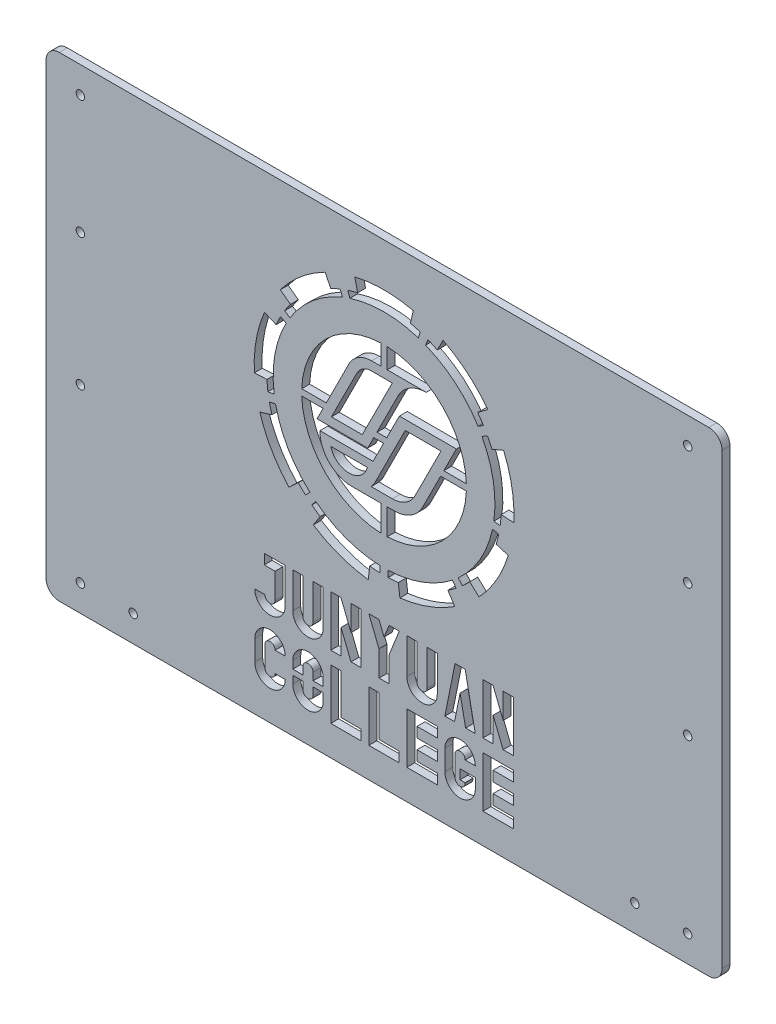
from build123d import *

# Parameters (mm, degrees)
MODEL_R             = 1.6
BOSS_EXTRUDE1_DEPTH = 3


with BuildPart() as part:
    # Model → Boss-Extrude1 (new body)
    with BuildSketch(Plane.XY):
        with BuildLine():
            Line((7.715859844, 183.30897554), (253.715859844, 183.30897554))
            ThreePointArc((253.715859844, 183.30897554), (257.251393749, 181.844509446), (258.715859844, 178.30897554))
            Line((258.715859844, 178.30897554), (258.715859844, 8.30897554))
            ThreePointArc((258.715859844, 8.30897554), (257.251393749, 4.773441634), (253.715859844, 3.30897554))
            Line((253.715859844, 3.30897554), (7.715859844, 3.30897554))
            ThreePointArc((7.715859844, 3.30897554), (4.180325938, 4.773441634), (2.715859844, 8.30897554))
            Line((2.715859844, 8.30897554), (2.715859844, 178.30897554))
            ThreePointArc((2.715859844, 178.30897554), (4.180325938, 181.844509446), (7.715859844, 183.30897554))
        make_face()
        with Locations((15.715859844, 173.30897554)):
            Circle(MODEL_R, mode=Mode.SUBTRACT)
        with Locations((15.715859844, 128.30897554)):
            Circle(MODEL_R, mode=Mode.SUBTRACT)
        with Locations((15.715859844, 78.30897554)):
            Circle(MODEL_R, mode=Mode.SUBTRACT)
        with Locations((245.715859844, 173.30897554)):
            Circle(MODEL_R, mode=Mode.SUBTRACT)
        with Locations((245.715859844, 128.30897554)):
            Circle(MODEL_R, mode=Mode.SUBTRACT)
        with Locations((245.715859844, 78.30897554)):
            Circle(MODEL_R, mode=Mode.SUBTRACT)
        with Locations((15.715859844, 13.30897554)):
            Circle(MODEL_R, mode=Mode.SUBTRACT)
        with Locations((245.715859844, 13.30897554)):
            Circle(MODEL_R, mode=Mode.SUBTRACT)
        with Locations((35.715859844, 13.30897554)):
            Circle(MODEL_R, mode=Mode.SUBTRACT)
        with Locations((225.715859844, 13.30897554)):
            Circle(MODEL_R, mode=Mode.SUBTRACT)
        with BuildLine():
            Line((140.703686656, 160.968449305), (141.783451717, 165.645425616))
            ThreePointArc((141.783451717, 165.645425616), (130.715859844, 166.906418428), (119.64826797, 165.645425616))
            Line((119.64826797, 165.645425616), (120.728033031, 160.968449305))
            ThreePointArc((120.728033031, 160.968449305), (118.850475946, 160.491610551), (116.995505293, 159.933327752))
            Line((116.995505293, 159.933327752), (117.73714608, 157.650792113))
            ThreePointArc((117.73714608, 157.650792113), (130.715859844, 159.706418428), (143.694573607, 157.650792113))
            Line((143.694573607, 157.650792113), (144.436214394, 159.933327752))
            ThreePointArc((144.436214394, 159.933327752), (142.581243741, 160.491610551), (140.703686656, 160.968449305))
        make_face(mode=Mode.SUBTRACT)
        with BuildLine():
            Line((110.558681655, 157.267108102), (108.379527256, 161.543939418))
            ThreePointArc((108.379527256, 161.543939418), (99.090709447, 155.39580503), (91.422992749, 147.315717567))
            Line((91.422992749, 147.315717567), (95.256443197, 144.427005456))
            ThreePointArc((95.256443197, 144.427005456), (94.124657069, 142.854855348), (93.062524374, 141.23483376))
            Line((93.062524374, 141.23483376), (95.097839805, 139.963027526))
            ThreePointArc((95.097839805, 139.963027526), (103.718780237, 149.880285039), (114.98238292, 156.64814032))
            Line((114.98238292, 156.64814032), (114.083327096, 158.873381571))
            ThreePointArc((114.083327096, 158.873381571), (112.30347987, 158.108698855), (110.558681655, 157.267108102))
        make_face(mode=Mode.SUBTRACT)
        with BuildLine():
            Line((89.84544435, 135.054880533), (85.427021054, 136.93038995))
            ThreePointArc((85.427021054, 136.93038995), (82.263318395, 126.249908769), (81.583286734, 115.131489381))
            Line((81.583286734, 115.131489381), (86.3767085, 115.382701971))
            ThreePointArc((86.3767085, 115.382701971), (86.520268636, 113.450867016), (86.747957591, 111.527132746))
            Line((86.747957591, 111.527132746), (89.124600956, 111.861148188))
            ThreePointArc((89.124600956, 111.861148188), (89.353934217, 124.99964189), (93.632060943, 137.424224065))
            Line((93.632060943, 137.424224065), (91.512986721, 138.550955816))
            ThreePointArc((91.512986721, 138.550955816), (90.641073218, 136.821111127), (89.84544435, 135.054880533))
        make_face(mode=Mode.SUBTRACT)
        with BuildLine():
            Line((88.255928679, 104.725114739), (83.66566585, 103.321730556))
            ThreePointArc((83.66566585, 103.321730556), (88.107409977, 93.106418428), (94.733257724, 84.152099113))
            Line((94.733257724, 84.152099113), (98.243755492, 87.425691241))
            ThreePointArc((98.243755492, 87.425691241), (99.595488509, 86.038098486), (101.006460921, 84.710788177))
            Line((101.006460921, 84.710788177), (102.612374376, 86.494335758))
            ThreePointArc((102.612374376, 86.494335758), (94.342792885, 96.706418428), (89.633660613, 108.974127414))
            Line((89.633660613, 108.974127414), (87.286106371, 108.475139356))
            ThreePointArc((87.286106371, 108.475139356), (87.730104611, 106.589546248), (88.255928679, 104.725114739))
        make_face(mode=Mode.SUBTRACT)
        with BuildLine():
            Line((106.533886689, 80.469445211), (103.919619321, 76.443826485))
            ThreePointArc((103.919619321, 76.443826485), (113.888468792, 71.473541486), (124.719888148, 68.873147768))
            Line((124.719888148, 68.873147768), (125.304860996, 73.637369295))
            ThreePointArc((125.304860996, 73.637369295), (127.232275993, 73.443288811), (129.16632219, 73.333465709))
            Line((129.16632219, 73.333465709), (129.250080982, 75.732003693))
            ThreePointArc((129.250080982, 75.732003693), (116.351013824, 78.239328355), (104.85807788, 84.609966777))
            Line((104.85807788, 84.609966777), (103.380490339, 82.718740968))
            ThreePointArc((103.380490339, 82.718740968), (104.93264861, 81.559689413), (106.533886689, 80.469445211))
        make_face(mode=Mode.SUBTRACT)
        with BuildLine():
            Line((136.126858691, 73.637369295), (136.711831539, 68.873147768))
            ThreePointArc((136.711831539, 68.873147768), (147.543250895, 71.473541486), (157.512100366, 76.443826485))
            Line((157.512100366, 76.443826485), (154.897832998, 80.469445211))
            ThreePointArc((154.897832998, 80.469445211), (156.499071077, 81.559689413), (158.051229348, 82.718740968))
            Line((158.051229348, 82.718740968), (156.573641807, 84.609966777))
            ThreePointArc((156.573641807, 84.609966777), (145.080705863, 78.239328355), (132.181638705, 75.732003693))
            Line((132.181638705, 75.732003693), (132.265397497, 73.333465709))
            ThreePointArc((132.265397497, 73.333465709), (134.199443694, 73.443288811), (136.126858691, 73.637369295))
        make_face(mode=Mode.SUBTRACT)
        with BuildLine():
            Line((163.187964195, 87.425691241), (166.698461963, 84.152099113))
            ThreePointArc((166.698461963, 84.152099113), (173.32430971, 93.106418428), (177.766053837, 103.321730556))
            Line((177.766053837, 103.321730556), (173.175791008, 104.725114739))
            ThreePointArc((173.175791008, 104.725114739), (173.701615076, 106.589546248), (174.145613316, 108.475139356))
            Line((174.145613316, 108.475139356), (171.798059074, 108.974127414))
            ThreePointArc((171.798059074, 108.974127414), (167.088926802, 96.706418428), (158.819345311, 86.494335758))
            Line((158.819345311, 86.494335758), (160.425258766, 84.710788177))
            ThreePointArc((160.425258766, 84.710788177), (161.836231178, 86.038098486), (163.187964195, 87.425691241))
        make_face(mode=Mode.SUBTRACT)
        with BuildLine():
            Line((175.055011187, 115.382701971), (179.848432953, 115.131489381))
            ThreePointArc((179.848432953, 115.131489381), (179.168401292, 126.249908769), (176.004698633, 136.93038995))
            Line((176.004698633, 136.93038995), (171.586275337, 135.054880533))
            ThreePointArc((171.586275337, 135.054880533), (170.790646469, 136.821111127), (169.918732966, 138.550955816))
            Line((169.918732966, 138.550955816), (167.799658744, 137.424224065))
            ThreePointArc((167.799658744, 137.424224065), (172.07778547, 124.99964189), (172.307118731, 111.861148188))
            Line((172.307118731, 111.861148188), (174.683762096, 111.527132746))
            ThreePointArc((174.683762096, 111.527132746), (174.911451051, 113.450867016), (175.055011187, 115.382701971))
        make_face(mode=Mode.SUBTRACT)
        with BuildLine():
            Line((166.17527649, 144.427005456), (170.008726938, 147.315717567))
            ThreePointArc((170.008726938, 147.315717567), (162.34101024, 155.39580503), (153.052192431, 161.543939418))
            Line((153.052192431, 161.543939418), (150.873038032, 157.267108102))
            ThreePointArc((150.873038032, 157.267108102), (149.128239817, 158.108698855), (147.348392591, 158.873381571))
            Line((147.348392591, 158.873381571), (146.449336767, 156.64814032))
            ThreePointArc((146.449336767, 156.64814032), (157.71293945, 149.880285039), (166.333879882, 139.963027526))
            Line((166.333879882, 139.963027526), (168.369195313, 141.23483376))
            ThreePointArc((168.369195313, 141.23483376), (167.307062618, 142.854855348), (166.17527649, 144.427005456))
        make_face(mode=Mode.SUBTRACT)
        with BuildLine():
            Line((136.524344384, 128.433865169), (158.124344384, 128.433865169))
            Line((158.124344384, 128.433865169), (153.340149806, 118.906418428))
            Line((153.340149806, 118.906418428), (161.89277438, 118.906418428))
            ThreePointArc((161.89277438, 118.906418428), (152.777591417, 139.768150001), (131.915859844, 148.883332964))
            Line((131.915859844, 148.883332964), (131.915859844, 141.288514406))
            Line((131.915859844, 141.288514406), (146.683146191, 141.288514406))
            ThreePointArc((146.683146191, 141.288514406), (140.383140858, 139.501737834), (135.959252513, 134.673503206))
            Line((135.959252513, 134.673503206), (128.041832078, 118.906418428))
            Line((128.041832078, 118.906418428), (131.740149806, 118.906418428))
            Line((131.740149806, 118.906418428), (136.524344384, 128.433865169))
        make_face(mode=Mode.SUBTRACT)
        with BuildLine():
            Line((138.744996792, 124.833865169), (152.288221651, 124.833865169))
            Line((152.288221651, 124.833865169), (142.456251256, 105.2540649))
            ThreePointArc((142.456251256, 105.2540649), (138.91714058, 101.391477198), (133.877136314, 99.962055941))
            Line((133.877136314, 99.962055941), (125.833827302, 99.962055941))
            ThreePointArc((125.833827302, 99.962055941), (126.727093366, 101.111806319), (127.463654057, 102.36772373))
            Line((127.463654057, 102.36772373), (138.744996792, 124.833865169))
        make_face(mode=Mode.SUBTRACT)
        with BuildLine():
            Line((130.534993031, 116.506418428), (126.561498077, 108.593433092))
            Line((126.561498077, 108.593433092), (106.428991116, 108.593433092))
            ThreePointArc((106.428991116, 108.593433092), (109.860065286, 99.958976916), (118.426760268, 96.362055941))
            Line((118.426760268, 96.362055941), (129.515859844, 96.362055941))
            Line((129.515859844, 96.362055941), (129.515859844, 86.529503892))
            ThreePointArc((129.515859844, 86.529503892), (108.65412827, 95.644686855), (99.538945307, 116.506418428))
            Line((99.538945307, 116.506418428), (107.636675303, 116.506418428))
            Line((107.636675303, 116.506418428), (105.342778401, 111.938255448))
            Line((105.342778401, 111.938255448), (124.542778401, 111.938255448))
            Line((124.542778401, 111.938255448), (126.836675303, 116.506418428))
            Line((126.836675303, 116.506418428), (130.534993031, 116.506418428))
        make_face(mode=Mode.SUBTRACT)
        with BuildLine():
            Line((124.408213516, 105.523614063), (110.502275677, 105.523614063))
            ThreePointArc((110.502275677, 105.523614063), (117.455244597, 100.193433092), (124.408213516, 105.523614063))
        make_face(mode=Mode.SUBTRACT)
        with BuildLine():
            Line((152.134993031, 116.506418428), (145.341247461, 102.97706714))
            ThreePointArc((145.341247461, 102.97706714), (140.917359116, 98.148832512), (134.617353783, 96.362055941))
            Line((134.617353783, 96.362055941), (131.915859844, 96.362055941))
            Line((131.915859844, 96.362055941), (131.915859844, 86.529503892))
            ThreePointArc((131.915859844, 86.529503892), (152.777591417, 95.644686855), (161.89277438, 116.506418428))
            Line((161.89277438, 116.506418428), (152.134993031, 116.506418428))
        make_face(mode=Mode.SUBTRACT)
        with BuildLine():
            Line((122.470169487, 115.298255448), (110.789826285, 115.298255448))
            Line((110.789826285, 115.298255448), (120.42628654, 134.488708582))
            ThreePointArc((120.42628654, 134.488708582), (122.726708479, 136.999390589), (126.002711252, 137.928514406))
            Line((126.002711252, 137.928514406), (133.833923614, 137.928514406))
            Line((133.833923614, 137.928514406), (122.470169487, 115.298255448))
        make_face(mode=Mode.SUBTRACT)
        with BuildLine():
            Line((117.42359631, 135.996505446), (108.841832078, 118.906418428))
            Line((108.841832078, 118.906418428), (99.538945307, 118.906418428))
            ThreePointArc((99.538945307, 118.906418428), (108.65412827, 139.768150001), (129.515859844, 148.883332964))
            Line((129.515859844, 148.883332964), (129.515859844, 141.288514406))
            Line((129.515859844, 141.288514406), (126.002711252, 141.288514406))
            ThreePointArc((126.002711252, 141.288514406), (120.962706986, 139.859093149), (117.42359631, 135.996505446))
        make_face(mode=Mode.SUBTRACT)
        with BuildLine():
            Line((85.355859844, 57.847984496), (93.275859844, 57.847984496))
            Line((93.275859844, 57.847984496), (93.275859844, 44.407984496))
            ThreePointArc((93.275859844, 44.407984496), (87.515859844, 38.647984496), (81.755859844, 44.407984496))
            Line((81.755859844, 44.407984496), (85.595859844, 44.407984496))
            ThreePointArc((85.595859844, 44.407984496), (87.515859844, 42.487984496), (89.435859844, 44.407984496))
            Line((89.435859844, 44.407984496), (89.435859844, 54.007984496))
            Line((89.435859844, 54.007984496), (85.355859844, 54.007984496))
            Line((85.355859844, 54.007984496), (85.355859844, 57.847984496))
        make_face(mode=Mode.SUBTRACT)
        with BuildLine():
            Line((107.675859844, 57.847984496), (107.675859844, 44.407984496))
            ThreePointArc((107.675859844, 44.407984496), (101.915859844, 38.647984496), (96.155859844, 44.407984496))
            Line((96.155859844, 44.407984496), (96.155859844, 57.847984496))
            Line((96.155859844, 57.847984496), (99.995859844, 57.847984496))
            Line((99.995859844, 57.847984496), (99.995859844, 44.407984496))
            ThreePointArc((99.995859844, 44.407984496), (101.915859844, 42.487984496), (103.835859844, 44.407984496))
            Line((103.835859844, 44.407984496), (103.835859844, 57.847984496))
            Line((103.835859844, 57.847984496), (107.675859844, 57.847984496))
        make_face(mode=Mode.SUBTRACT)
        Polygon((122.075859844, 57.847984496), (122.075859844, 38.647984496), (118.198541182, 38.647984496), (114.43227593, 48.063647626), (114.467319859, 38.647984496), (110.555859844, 38.647984496), (110.555859844, 57.847984496), (114.395859844, 57.847984496), (118.235859844, 48.247984496), (118.235859844, 57.847984496), align=None, mode=Mode.SUBTRACT)
        Polygon((128.795859844, 48.247984496), (128.830903772, 38.647984496), (132.600815915, 38.647984496), (132.635859844, 48.247984496), (136.475859844, 57.847984496), (132.635859844, 57.847984496), (130.715859844, 53.047984496), (128.795859844, 57.847984496), (124.955859844, 57.847984496), align=None, mode=Mode.SUBTRACT)
        with BuildLine():
            Line((150.875859844, 57.847984496), (150.875859844, 44.407984496))
            ThreePointArc((150.875859844, 44.407984496), (145.115859844, 38.647984496), (139.355859844, 44.407984496))
            Line((139.355859844, 44.407984496), (139.355859844, 57.847984496))
            Line((139.355859844, 57.847984496), (143.195859844, 57.847984496))
            Line((143.195859844, 57.847984496), (143.195859844, 44.407984496))
            ThreePointArc((143.195859844, 44.407984496), (145.115859844, 42.487984496), (147.035859844, 44.407984496))
            Line((147.035859844, 44.407984496), (147.035859844, 57.847984496))
            Line((147.035859844, 57.847984496), (150.875859844, 57.847984496))
        make_face(mode=Mode.SUBTRACT)
        Polygon((165.275859844, 38.647984496), (161.604565794, 38.647984496), (159.515859844, 49.091514247), (157.427153893, 38.647984496), (153.755859844, 38.647984496), (157.595859844, 57.847984496), (161.435859844, 57.847984496), align=None, mode=Mode.SUBTRACT)
        Polygon((179.675859844, 57.847984496), (179.675859844, 38.647984496), (175.798541182, 38.647984496), (172.03227593, 48.063647626), (172.067319859, 38.647984496), (168.155859844, 38.647984496), (168.155859844, 57.847984496), (171.995859844, 57.847984496), (175.835859844, 48.247984496), (175.835859844, 57.847984496), align=None, mode=Mode.SUBTRACT)
        with BuildLine():
            Line((81.755859844, 28.087984496), (81.755859844, 20.407984496))
            ThreePointArc((81.755859844, 20.407984496), (87.515859844, 14.647984496), (93.275859844, 20.407984496))
            Line((93.275859844, 20.407984496), (89.435859844, 20.407984496))
            ThreePointArc((89.435859844, 20.407984496), (87.515859844, 18.487984496), (85.595859844, 20.407984496))
            Line((85.595859844, 20.407984496), (85.595859844, 28.087984496))
            ThreePointArc((85.595859844, 28.087984496), (87.515859844, 30.007984496), (89.435859844, 28.087984496))
            Line((89.435859844, 28.087984496), (93.275859844, 28.087984496))
            ThreePointArc((93.275859844, 28.087984496), (87.515859844, 33.847984496), (81.755859844, 28.087984496))
        make_face(mode=Mode.SUBTRACT)
        with BuildLine():
            Line((96.155859844, 28.087984496), (96.155859844, 25.247984496))
            Line((96.155859844, 25.247984496), (99.995859844, 25.247984496))
            Line((99.995859844, 25.247984496), (99.995859844, 28.087984496))
            ThreePointArc((99.995859844, 28.087984496), (101.915859844, 30.007984496), (103.835859844, 28.087984496))
            Line((103.835859844, 28.087984496), (103.835859844, 25.247984496))
            Line((103.835859844, 25.247984496), (107.675859844, 25.247984496))
            Line((107.675859844, 25.247984496), (107.675859844, 28.087984496))
            ThreePointArc((107.675859844, 28.087984496), (101.915859844, 33.847984496), (96.155859844, 28.087984496))
        make_face(mode=Mode.SUBTRACT)
        Polygon((110.555859844, 33.847984496), (110.555859844, 14.647984496), (122.075859844, 14.647984496), (122.075859844, 18.487984496), (114.395859844, 18.487984496), (114.395859844, 33.847984496), align=None, mode=Mode.SUBTRACT)
        Polygon((124.955859844, 33.847984496), (124.955859844, 14.647984496), (136.475859844, 14.647984496), (136.475859844, 18.487984496), (128.795859844, 18.487984496), (128.795859844, 33.847984496), align=None, mode=Mode.SUBTRACT)
        Polygon((139.355859844, 33.847984496), (139.355859844, 14.647984496), (150.875859844, 14.647984496), (150.875859844, 18.487984496), (143.195859844, 18.487984496), (143.195859844, 22.327984496), (150.875859844, 22.327984496), (150.875859844, 26.167984496), (143.195859844, 26.167984496), (143.195859844, 30.007984496), (150.875859844, 30.007984496), (150.875859844, 33.847984496), align=None, mode=Mode.SUBTRACT)
        Polygon((168.155859844, 33.847984496), (168.155859844, 14.647984496), (179.675859844, 14.647984496), (179.675859844, 18.487984496), (171.995859844, 18.487984496), (171.995859844, 22.327984496), (179.675859844, 22.327984496), (179.675859844, 26.167984496), (171.995859844, 26.167984496), (171.995859844, 30.007984496), (179.675859844, 30.007984496), (179.675859844, 33.847984496), align=None, mode=Mode.SUBTRACT)
        with BuildLine():
            Line((153.755859844, 28.087984496), (153.755859844, 20.407984496))
            ThreePointArc((153.755859844, 20.407984496), (159.515859844, 14.647984496), (165.275859844, 20.407984496))
            Line((165.275859844, 20.407984496), (165.275859844, 24.247984496))
            Line((165.275859844, 24.247984496), (159.515859844, 24.247984496))
            Line((159.515859844, 24.247984496), (159.515859844, 20.647984496))
            Line((159.515859844, 20.647984496), (161.435859844, 20.647984496))
            Line((161.435859844, 20.647984496), (161.435859844, 20.407984496))
            ThreePointArc((161.435859844, 20.407984496), (159.515859844, 18.487984496), (157.595859844, 20.407984496))
            Line((157.595859844, 20.407984496), (157.595859844, 28.087984496))
            ThreePointArc((157.595859844, 28.087984496), (159.515859844, 30.007984496), (161.435859844, 28.087984496))
            Line((161.435859844, 28.087984496), (165.275859844, 28.087984496))
            ThreePointArc((165.275859844, 28.087984496), (159.515859844, 33.847984496), (153.755859844, 28.087984496))
        make_face(mode=Mode.SUBTRACT)
        with BuildLine():
            Line((99.995859844, 23.247984496), (96.155859844, 23.247984496))
            Line((96.155859844, 23.247984496), (96.155859844, 20.407984496))
            ThreePointArc((96.155859844, 20.407984496), (101.915859844, 14.647984496), (107.675859844, 20.407984496))
            Line((107.675859844, 20.407984496), (107.675859844, 23.247984496))
            Line((107.675859844, 23.247984496), (103.835859844, 23.247984496))
            Line((103.835859844, 23.247984496), (103.835859844, 20.407984496))
            ThreePointArc((103.835859844, 20.407984496), (101.915859844, 18.487984496), (99.995859844, 20.407984496))
            Line((99.995859844, 20.407984496), (99.995859844, 23.247984496))
        make_face(mode=Mode.SUBTRACT)
    extrude(amount=BOSS_EXTRUDE1_DEPTH)


solid = part.part
